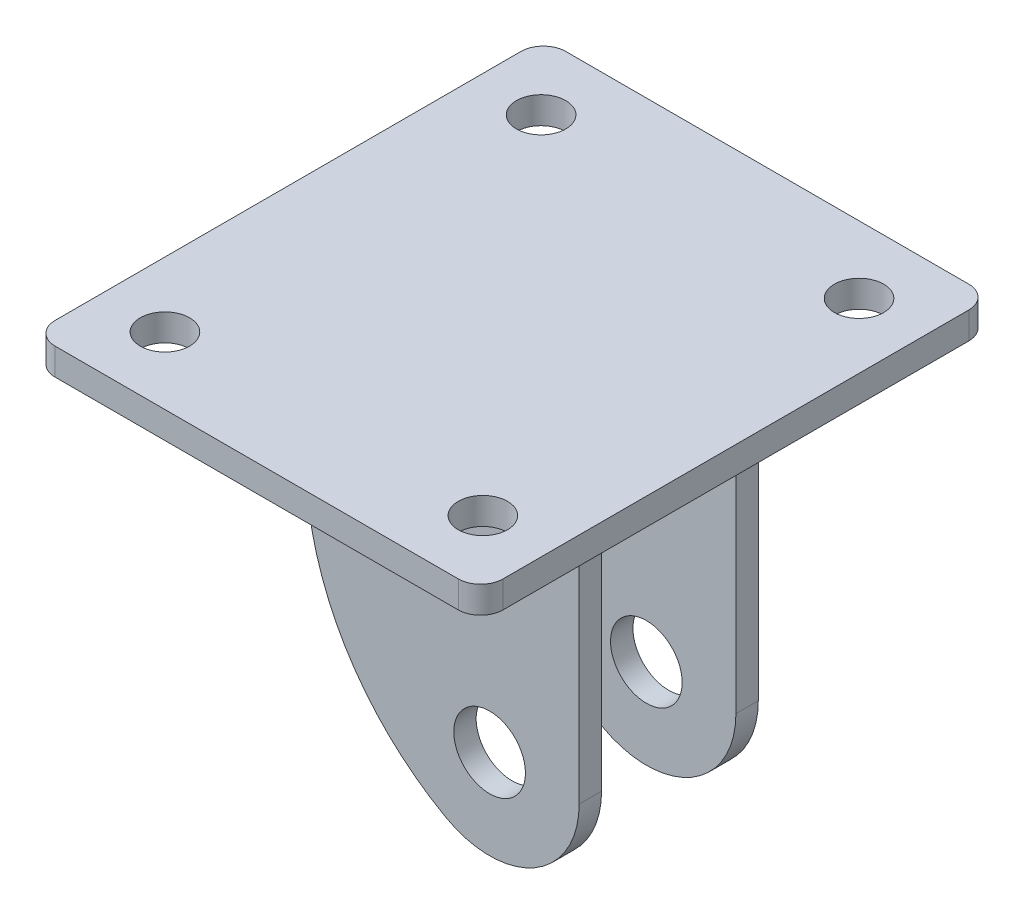
from build123d import *

# Parameters (mm, degrees)
BOSS_EXTRUDE1_DEPTH = 3
BOSS_EXTRUDE2_START = 20
SKETCH2_R           = 8
BOSS_EXTRUDE2_DEPTH = 5
SKETCH3_R           = 5.5
CUT_EXTRUDE1_DEPTH  = 116.445427837


with BuildPart() as part:
    # Sketch1 → Boss-Extrude1 (new, symmetric)
    with BuildSketch(Plane(origin=(0, 0, 0), x_dir=(1, 0, 0), z_dir=(0, 1, 0))):
        with BuildLine():
            Line((-45, -57), (45, -57))
            ThreePointArc((45, -57), (48.535533906, -55.535533906), (50, -52))
            Line((50, -52), (50, 52))
            ThreePointArc((50, 52), (48.535533906, 55.535533906), (45, 57))
            Line((45, 57), (-45, 57))
            ThreePointArc((-45, 57), (-48.535533906, 55.535533906), (-50, 52))
            Line((-50, 52), (-50, -52))
            ThreePointArc((-50, -52), (-48.535533906, -55.535533906), (-45, -57))
        make_face()
    extrude(amount=BOSS_EXTRUDE1_DEPTH, both=True)

    # Sketch2 → Boss-Extrude2 (add)
    with BuildSketch(Plane.XY.offset(BOSS_EXTRUDE2_START)):
        with BuildLine():
            Line((-25, -3), (-25, -17.338880751))
            ThreePointArc((-25, -17.338880751), (-20.170076441, -54.275307328), (5.241257633, -81.512999419))
            ThreePointArc((5.241257633, -81.512999419), (25.119909898, -81.306146184), (35, -64.055423774))
            Line((35, -64.055423774), (35, -3))
            Line((35, -3), (-25, -3))
        make_face()
        with Locations((15, -64.055423774)):
            Circle(SKETCH2_R, mode=Mode.SUBTRACT)
    boss_extrude2 = extrude(amount=-BOSS_EXTRUDE2_DEPTH)

    # Mirror1: Boss-Extrude2 across plane
    add(boss_extrude2.mirror(Plane.XY))

    # Sketch3 → Cut-Extrude1 (cut, through all)
    with BuildSketch(Plane(origin=(0, 3, 0), x_dir=(1, 0, 0), z_dir=(0, 1, 0))):
        with Locations(Location((35.5, 42, 0), (0, 0, 270))):
            Circle(SKETCH3_R)
        with Locations(Location((-35.5, 42, 0), (0, 0, 270))):
            Circle(SKETCH3_R)
        with Locations(Location((-35.5, -42, 0), (0, 0, 270))):
            Circle(SKETCH3_R)
        with Locations(Location((35.5, -42, 0), (0, 0, 270))):
            Circle(SKETCH3_R)
    extrude(amount=-CUT_EXTRUDE1_DEPTH, mode=Mode.SUBTRACT)


solid = part.part
